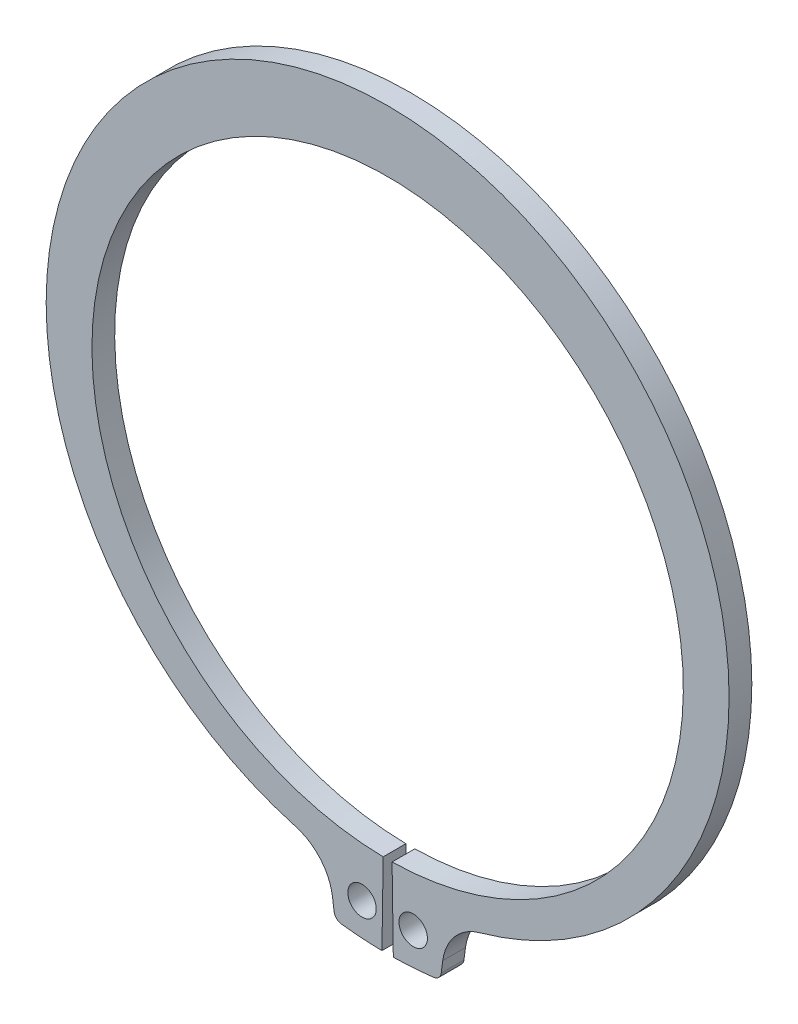
from build123d import *

# Parameters (mm, degrees)
BODYSKE_R  = 1.25
BODY_DEPTH = 2


with BuildPart() as part:
    # BodySke → Body (new body)
    with BuildSketch(Plane.XY):
        with BuildLine():
            Line((0.391566265, -25.997051292), (0.5, -33.196234726))
            ThreePointArc((0.5, -33.196234726), (2.282999989, -33.121411671), (4.059403737, -32.950891358))
            ThreePointArc((4.059403737, -32.950891358), (4.495819199, -32.739050942), (4.711283985, -32.304413457))
            Line((4.711283985, -32.304413457), (4.845963416, -31.281421613))
            ThreePointArc((4.845963416, -31.281421613), (5.907594805, -28.920841123), (8.094076679, -27.535670207))
            ThreePointArc((8.094076679, -27.535670207), (0, 31.4), (-8.094076679, -27.535670207))
            ThreePointArc((-8.094076679, -27.535670207), (-5.907594805, -28.920841123), (-4.845963416, -31.281421613))
            Line((-4.845963416, -31.281421613), (-4.711283985, -32.304413457))
            ThreePointArc((-4.711283985, -32.304413457), (-4.495819199, -32.739050942), (-4.059403737, -32.950891358))
            ThreePointArc((-4.059403737, -32.950891358), (-2.282999989, -33.121411671), (-0.5, -33.196234726))
            Line((-0.5, -33.196234726), (-0.391566265, -25.997051292))
            ThreePointArc((-0.391566265, -25.997051292), (0, 26), (0.391566265, -25.997051292))
        make_face()
        with Locations((2.25, -30.266483113)):
            Circle(BODYSKE_R, mode=Mode.SUBTRACT)
        with Locations((-2.25, -30.266483113)):
            Circle(BODYSKE_R, mode=Mode.SUBTRACT)
    extrude(amount=-BODY_DEPTH)


solid = part.part
